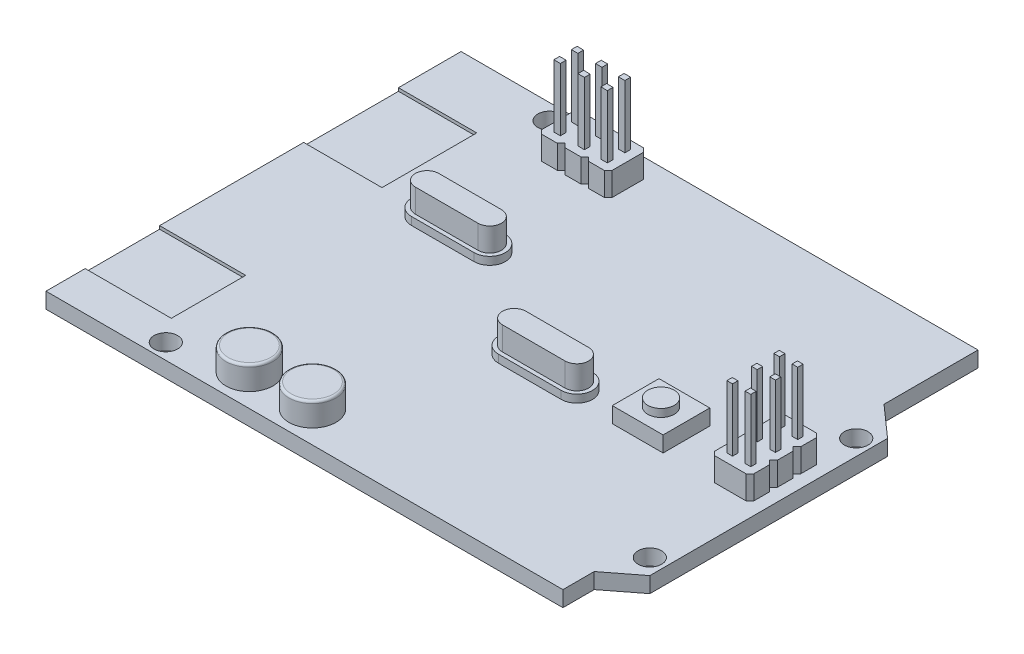
from build123d import *

# Parameters (mm, degrees)
BOSS_EXTRUDE1_DEPTH     = 2
CUT_EXTRUDE2_DEPTH      = 88.82368701
CUT_EXTRUDE2_DEPTH_BACK = 88.82368701
SKETCH2_R               = 1.5
CUT_EXTRUDE7_START      = 2
SKETCH3_W               = 10
SKETCH3_H               = 12.1
SKETCH3_W_2             = 11
SKETCH3_H_2             = 9.5
CUT_EXTRUDE7_DEPTH      = 0.4
BOSS_EXTRUDE2_DEPTH     = 3
LPATTERN1_COUNT         = 3
LPATTERN1_PITCH         = 3
SKETCH5_W               = 0.724136619
SKETCH5_H               = 0.689653923
BOSS_EXTRUDE4_DEPTH     = 8
BOSS_EXTRUDE5_DEPTH     = 3
LPATTERN3_COUNT         = 3
LPATTERN3_PITCH         = 3
SKETCH8_W               = 0.829728978
SKETCH8_H               = 0.730951718
BOSS_EXTRUDE6_DEPTH     = 8
SKETCH9_W               = 6.486986995
SKETCH9_H               = 5.963842883
BOSS_EXTRUDE7_DEPTH     = 2
SKETCH11_R              = 1.680495579
BOSS_EXTRUDE8_DEPTH     = 1
BOSS_EXTRUDE9_DEPTH     = 1
BOSS_EXTRUDE10_DEPTH    = 3
BOSS_EXTRUDE11_DEPTH    = 1
BOSS_EXTRUDE12_DEPTH    = 3
SKETCH16_R              = 3
BOSS_EXTRUDE13_DEPTH    = 3
FILLET1_R               = 0.3


with BuildPart() as part:
    # Sketch1 → Boss-Extrude1 (new body)
    with BuildSketch(Plane(origin=(0, 0, 0), x_dir=(1, 0, 0), z_dir=(0, 1, 0))):
        Polygon((0, 0), (66, 0), (66, 4), (70, 7.100943302), (70, 37.450193791), (66, 41), (66, 53), (0, 53), align=None)
    extrude(amount=BOSS_EXTRUDE1_DEPTH)

    # Sketch2 → Cut-Extrude2 (cut, two sides: drawn at the far end of the back side and taken through both)
    with BuildSketch(Plane(origin=(0, 0, 0), x_dir=(1, 0, 0), z_dir=(0, 1, 0)).offset(-CUT_EXTRUDE2_DEPTH_BACK)):
        with Locations(Location((68, 35.450193791, 0), (0, 0, 270))):
            Circle(SKETCH2_R)
        with Locations(Location((68, 9.100943302, 0), (0, 0, 270))):
            Circle(SKETCH2_R)
        with Locations(Location((13.3, 2, 0), (0, 0, 270))):
            Circle(SKETCH2_R)
        with Locations(Location((13.3, 51, 0), (0, 0, 270))):
            Circle(SKETCH2_R)
    extrude(amount=CUT_EXTRUDE2_DEPTH + CUT_EXTRUDE2_DEPTH_BACK, mode=Mode.SUBTRACT)

    # Sketch3 → Cut-Extrude7 (cut)
    with BuildSketch(Plane(origin=(0, 0, 0), x_dir=(1, 0, 0), z_dir=(0, 1, 0)).offset(CUT_EXTRUDE7_START)):
        with Locations((5, 38.95)):
            Rectangle(SKETCH3_W, SKETCH3_H)
        with Locations((5.5, 9.75)):
            Rectangle(SKETCH3_W_2, SKETCH3_H_2)
    extrude(amount=-CUT_EXTRUDE7_DEPTH, mode=Mode.SUBTRACT)

    # Sketch4 → Boss-Extrude2 (add)
    with BuildSketch(Plane(origin=(0, 2, 0), x_dir=(1, 0, 0), z_dir=(0, 1, 0))):
        Polygon((63.879895434, 30.5), (63.379895434, 30), (63.379895434, 28), (63.879895434, 27.5), (67.879895434, 27.5), (68.379895434, 28), (68.379895434, 30), (67.879895434, 30.5), align=None)
    boss_extrude2 = extrude(amount=BOSS_EXTRUDE2_DEPTH)

    # LPattern1: Boss-Extrude2 ×3
    with Locations(*[(0, 0, i * LPATTERN1_PITCH) for i in range(1, LPATTERN1_COUNT)]):
        add(boss_extrude2)

    # Sketch5 → Boss-Extrude4 (add)
    with BuildSketch(Plane(origin=(0, 5, 0), x_dir=(1, 0, 0), z_dir=(0, 1, 0))):
        with Locations((64.716683918, 28.923857239)):
            Rectangle(SKETCH5_W, SKETCH5_H)
        with Locations((67.04310695, 28.923857239)):
            Rectangle(SKETCH5_W, SKETCH5_H)
        with Locations((67.04310695, 26.076142762)):
            Rectangle(SKETCH5_W, SKETCH5_H)
        with Locations((64.716683918, 26.076142762)):
            Rectangle(SKETCH5_W, SKETCH5_H)
        with Locations((67.04310695, 22.923857239)):
            Rectangle(SKETCH5_W, SKETCH5_H)
        with Locations((64.716683918, 22.923857239)):
            Rectangle(SKETCH5_W, SKETCH5_H)
    extrude(amount=BOSS_EXTRUDE4_DEPTH)

    # Sketch6 → Boss-Extrude5 (add)
    with BuildSketch(Plane(origin=(0, 2, 0), x_dir=(1, 0, 0), z_dir=(0, 1, 0))):
        Polygon((17.282939777, 51), (19.282939777, 51), (19.782939777, 50.5), (19.782939777, 46.5), (19.282939777, 46), (17.282939777, 46), (16.782939777, 46.5), (16.782939777, 50.5), align=None)
    boss_extrude5 = extrude(amount=BOSS_EXTRUDE5_DEPTH)

    # LPattern3: Boss-Extrude5 ×3
    with Locations(*[(i * LPATTERN3_PITCH, 0, 0) for i in range(1, LPATTERN3_COUNT)]):
        add(boss_extrude5)

    # Sketch8 → Boss-Extrude6 (add)
    with BuildSketch(Plane(origin=(0, 5, 0), x_dir=(1, 0, 0), z_dir=(0, 1, 0))):
        with Locations((21.321404848, 49.61932377)):
            Rectangle(SKETCH8_W, SKETCH8_H)
        with Locations((18.244474705, 49.61932377)):
            Rectangle(SKETCH8_W, SKETCH8_H)
        with Locations((24.244474705, 49.61932377)):
            Rectangle(SKETCH8_W, SKETCH8_H)
        with Locations((24.244474705, 47.38067623)):
            Rectangle(SKETCH8_W, SKETCH8_H)
        with Locations((21.321404848, 47.38067623)):
            Rectangle(SKETCH8_W, SKETCH8_H)
        with Locations((18.244474705, 47.38067623)):
            Rectangle(SKETCH8_W, SKETCH8_H)
    extrude(amount=BOSS_EXTRUDE6_DEPTH)

    # Sketch9 → Boss-Extrude7 (add)
    with BuildSketch(Plane(origin=(0, 2, 0), x_dir=(1, 0, 0), z_dir=(0, 1, 0))):
        with Locations((54.045911219, 24.481921441)):
            Rectangle(SKETCH9_W, SKETCH9_H)
    extrude(amount=BOSS_EXTRUDE7_DEPTH)

    # Sketch11 → Boss-Extrude8 (add)
    with BuildSketch(Plane(origin=(0, 4, 0), x_dir=(1, 0, 0), z_dir=(0, 1, 0))):
        with Locations(Location((54.04591122, 24.481921441, 0), (0, 0, 270))):
            Circle(SKETCH11_R)
    extrude(amount=BOSS_EXTRUDE8_DEPTH)

    # Sketch12 → Boss-Extrude9 (add)
    with BuildSketch(Plane(origin=(0, 2, 0), x_dir=(1, 0, 0), z_dir=(0, 1, 0))):
        with BuildLine():
            Line((36.85972443, 24.919811949), (44.85972443, 24.919811949))
            ThreePointArc((44.85972443, 24.919811949), (46.85972443, 22.919811949), (44.85972443, 20.919811949))
            Line((44.85972443, 20.919811949), (36.85972443, 20.919811949))
            ThreePointArc((36.85972443, 20.919811949), (34.85972443, 22.919811949), (36.85972443, 24.919811949))
        make_face()
    extrude(amount=BOSS_EXTRUDE9_DEPTH)

    # Sketch13 → Boss-Extrude10 (add)
    with BuildSketch(Plane(origin=(0, 3, 0), x_dir=(1, 0, 0), z_dir=(0, 1, 0))):
        with BuildLine():
            Line((44.85972443, 24.419811949), (36.85972443, 24.419811949))
            ThreePointArc((36.85972443, 24.419811949), (35.35972443, 22.919811949), (36.85972443, 21.419811949))
            Line((36.85972443, 21.419811949), (44.85972443, 21.419811949))
            ThreePointArc((44.85972443, 21.419811949), (46.35972443, 22.919811949), (44.85972443, 24.419811949))
        make_face()
    extrude(amount=BOSS_EXTRUDE10_DEPTH)

    # Sketch14 → Boss-Extrude11 (add)
    with BuildSketch(Plane(origin=(0, 2, 0), x_dir=(1, 0, 0), z_dir=(0, 1, 0))):
        with BuildLine():
            Line((16.059725168, 34.595333511), (24.059725168, 34.595333511))
            ThreePointArc((24.059725168, 34.595333511), (26.059725168, 32.595333511), (24.059725168, 30.595333511))
            Line((24.059725168, 30.595333511), (16.059725168, 30.595333511))
            ThreePointArc((16.059725168, 30.595333511), (14.059725168, 32.595333511), (16.059725168, 34.595333511))
        make_face()
    extrude(amount=BOSS_EXTRUDE11_DEPTH)

    # Sketch15 → Boss-Extrude12 (add)
    with BuildSketch(Plane(origin=(0, 3, 0), x_dir=(1, 0, 0), z_dir=(0, 1, 0))):
        with BuildLine():
            Line((16.059725168, 31.095333511), (24.059725168, 31.095333511))
            ThreePointArc((24.059725168, 31.095333511), (25.559725168, 32.595333511), (24.059725168, 34.095333511))
            Line((24.059725168, 34.095333511), (16.059725168, 34.095333511))
            ThreePointArc((16.059725168, 34.095333511), (14.559725168, 32.595333511), (16.059725168, 31.095333511))
        make_face()
    extrude(amount=BOSS_EXTRUDE12_DEPTH)

    # Sketch16 → Boss-Extrude13 (add)
    with BuildSketch(Plane(origin=(0, 2, 0), x_dir=(1, 0, 0), z_dir=(0, 1, 0))):
        with Locations(Location((21.969175252, 4, 0), (0, 0, 270))):
            Circle(SKETCH16_R)
        with Locations(Location((30.025126654, 4, 0), (0, 0, 270))):
            Circle(SKETCH16_R)
    extrude(amount=BOSS_EXTRUDE13_DEPTH)

    # Fillet1
    fillet1_edges = [part.edges().sort_by_distance(p)[0] for p in [
        (21.969175252, 5, -7),
        (30.025126654, 5, -7),
    ]]
    fillet(fillet1_edges, radius=FILLET1_R)


solid = part.part
